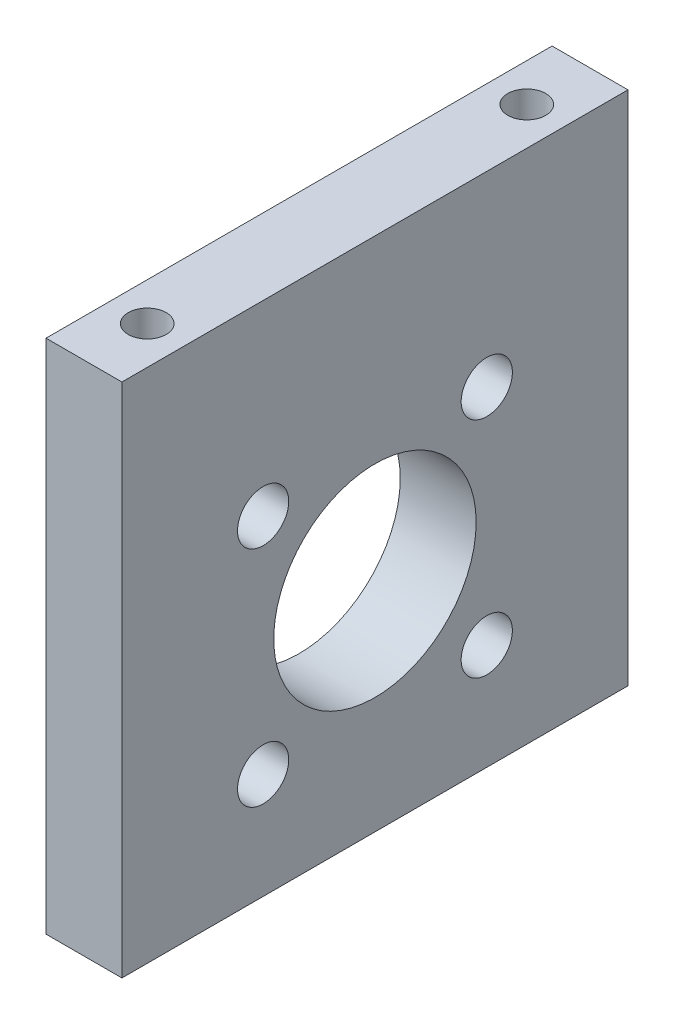
from build123d import *

# Parameters (mm, degrees)
SKETCH_1_W               = 40
SKETCH_1_H               = 40.8
SKETCH_1_R               = 8
SKETCH_1_R_2             = 2.025
EXTRUDE_1_DEPTH          = 6
CUT_EXTRUDE_1_DEPTH      = 32.511267826
CUT_EXTRUDE_1_DEPTH_BACK = 32.511267826
SKETCH_2_R               = 1.5


with BuildPart() as part:
    # 草图1 → 凸台-拉伸1 (new body)
    with BuildSketch(Plane(origin=(0, 0, 0), x_dir=(0, 0, -1), z_dir=(1, 0, 0))):
        with Locations((0, 3.2)):
            Rectangle(SKETCH_1_W, SKETCH_1_H)
        Circle(SKETCH_1_R, mode=Mode.SUBTRACT)
        with Locations((-8.838834765, 8.838834765)):
            Circle(SKETCH_1_R_2, mode=Mode.SUBTRACT)
        with Locations((8.838834765, 8.838834765)):
            Circle(SKETCH_1_R_2, mode=Mode.SUBTRACT)
        with Locations((8.838834765, -8.838834765)):
            Circle(SKETCH_1_R_2, mode=Mode.SUBTRACT)
        with Locations((-8.838834765, -8.838834765)):
            Circle(SKETCH_1_R_2, mode=Mode.SUBTRACT)
    extrude(amount=EXTRUDE_1_DEPTH)

    # 草图2 → 切除-拉伸1 (cut, two sides: drawn at the far end of the back side and taken through both)
    with BuildSketch(Plane(origin=(0, 0, 0), x_dir=(1, 0, 0), z_dir=(0, 1, 0)).offset(-CUT_EXTRUDE_1_DEPTH_BACK)):
        with Locations(Location((3, 15, 0), (0, 0, 270))):
            Circle(SKETCH_2_R)
        with Locations(Location((3, -15, 0), (0, 0, 270))):
            Circle(SKETCH_2_R)
    extrude(amount=CUT_EXTRUDE_1_DEPTH + CUT_EXTRUDE_1_DEPTH_BACK, mode=Mode.SUBTRACT)


solid = part.part
